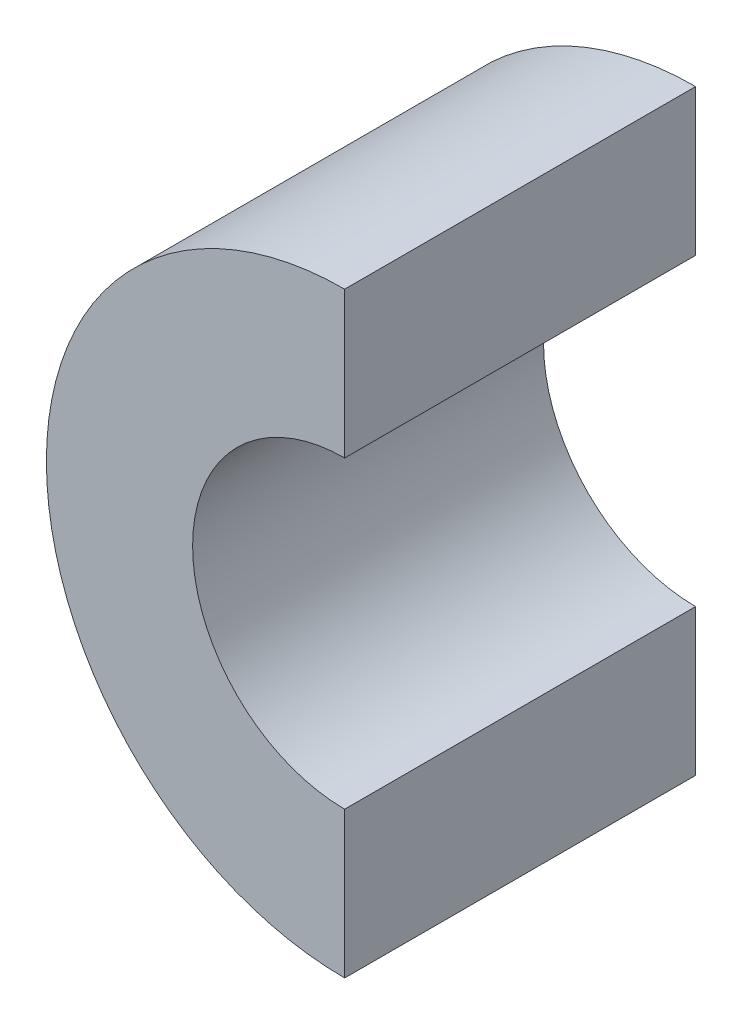
from build123d import *

# Parameters (mm, degrees)
BOSS_EXTRUDE1_DEPTH = 12


with BuildPart() as part:
    # Sketch1 → Boss-Extrude1 (new body)
    with BuildSketch(Plane.XY):
        with BuildLine():
            Line((0, 10.2), (0, 5.2))
            ThreePointArc((0, 5.2), (-5.2, 0), (0, -5.2))
            Line((0, -5.2), (0, -10.2))
            ThreePointArc((0, -10.2), (-10.2, 0), (0, 10.2))
        make_face()
    extrude(amount=BOSS_EXTRUDE1_DEPTH)


solid = part.part
